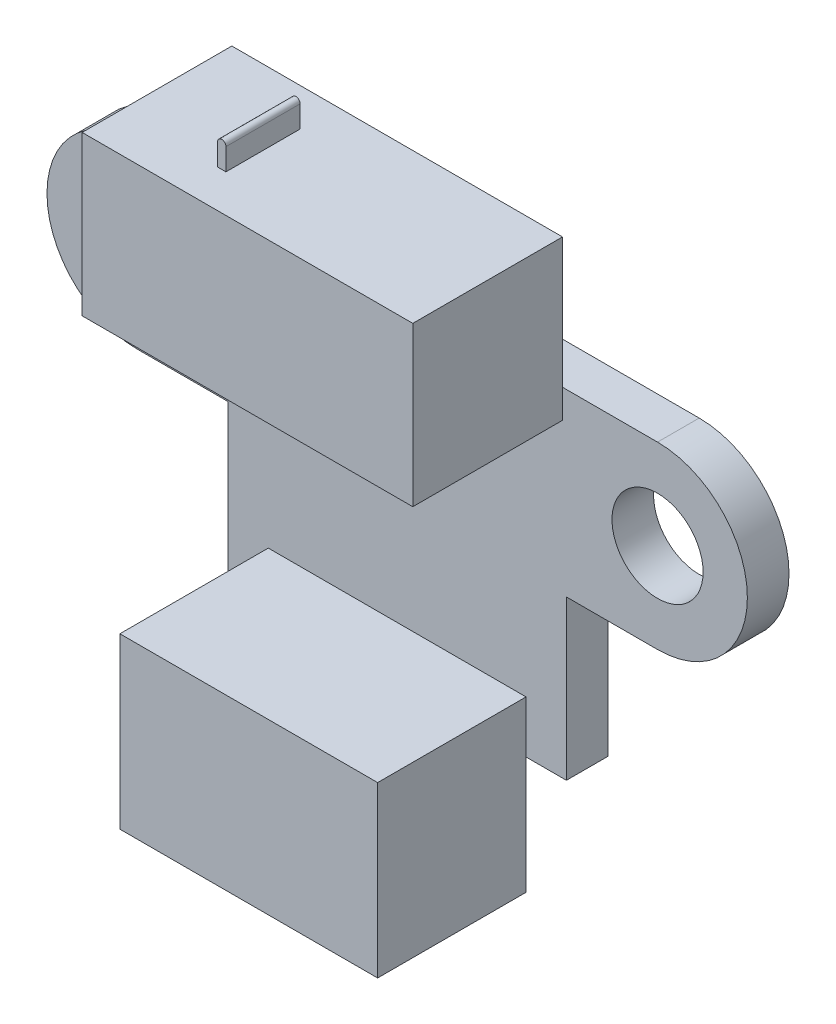
from build123d import *

# Parameters (mm, degrees)
BOSS_EXTRUDE1_DEPTH = 1.6
SKETCH2_W           = 9.9
SKETCH2_H           = 6.5
BOSS_EXTRUDE2_DEPTH = 5.7
SKETCH3_W           = 8.4
SKETCH3_H           = 4.2
CUT_EXTRUDE1_DEPTH  = 5.75
SKETCH4_R           = 1.75
CUT_EXTRUDE2_DEPTH  = 5.75
SKETCH5_W           = 12.7
SKETCH5_H           = 6.1
BOSS_EXTRUDE3_DEPTH = 5.75
BOSS_EXTRUDE4_DEPTH = 5.75
SKETCH8_W           = 1.45
SKETCH8_H           = 1.30003701
CUT_EXTRUDE3_DEPTH  = 10


with BuildPart() as part:
    # Sketch1 → Boss-Extrude1 (new body)
    with BuildSketch(Plane.XY):
        with BuildLine():
            Line((0, -6.9), (0, -13))
            Line((0, -13), (13, -13))
            Line((13, -13), (13, -6.9))
            Line((13, -6.9), (16.5, -6.9))
            ThreePointArc((16.5, -6.9), (19.95, -3.45), (16.5, 0))
            Line((16.5, 0), (13, 0))
            Line((13, 0), (0, 0))
            Line((0, 0), (-3.5, 0))
            ThreePointArc((-3.5, 0), (-6.95, -3.45), (-3.5, -6.9))
            Line((-3.5, -6.9), (0, -6.9))
        make_face()
    extrude(amount=BOSS_EXTRUDE1_DEPTH)

    # Sketch2 → Boss-Extrude2 (add)
    with BuildSketch(Plane.XY.offset(1.6)):
        with Locations((6.5, -14.25)):
            Rectangle(SKETCH2_W, SKETCH2_H)
    extrude(amount=BOSS_EXTRUDE2_DEPTH)

    # Sketch3 → Cut-Extrude1 (cut)
    with BuildSketch(Plane.XZ.offset(17.5)):
        with Locations((6.5, 4.45)):
            Rectangle(SKETCH3_W, SKETCH3_H)
    extrude(amount=-CUT_EXTRUDE1_DEPTH, mode=Mode.SUBTRACT)

    # Sketch4 → Cut-Extrude2 (cut)
    with BuildSketch(Plane.XY.offset(1.6)):
        with Locations((-3.5, -3.45)):
            Circle(SKETCH4_R)
        with Locations((16.5, -3.45)):
            Circle(SKETCH4_R)
    extrude(amount=-CUT_EXTRUDE2_DEPTH, mode=Mode.SUBTRACT)

    # Sketch5 → Boss-Extrude3 (add)
    with BuildSketch(Plane.XY.offset(1.6)):
        with Locations((6.5, 1.95)):
            Rectangle(SKETCH5_W, SKETCH5_H)
    extrude(amount=BOSS_EXTRUDE3_DEPTH)

    # Sketch7 → Boss-Extrude4 (add)
    with BuildSketch(Plane.XY.offset(7.35)):
        with BuildLine():
            Line((3.9, 5), (3.9, 5.838508632))
            ThreePointArc((3.9, 5.838508632), (4.061491368, 6), (4.222982736, 5.838508632))
            Line((4.222982736, 5.838508632), (4.222982736, 5))
            Line((4.222982736, 5), (3.9, 5))
        make_face()
    extrude(amount=-BOSS_EXTRUDE4_DEPTH)

    # Sketch8 → Cut-Extrude3 (cut)
    with BuildSketch(Plane(origin=(12.85, 0, 0), x_dir=(0, 0, -1), z_dir=(1, 0, 0))):
        with Locations((-6.625, 5.650018505)):
            Rectangle(SKETCH8_W, SKETCH8_H)
        with Locations((-2.325, 5.650018505)):
            Rectangle(SKETCH8_W, SKETCH8_H)
    extrude(amount=-CUT_EXTRUDE3_DEPTH, mode=Mode.SUBTRACT)


solid = part.part
